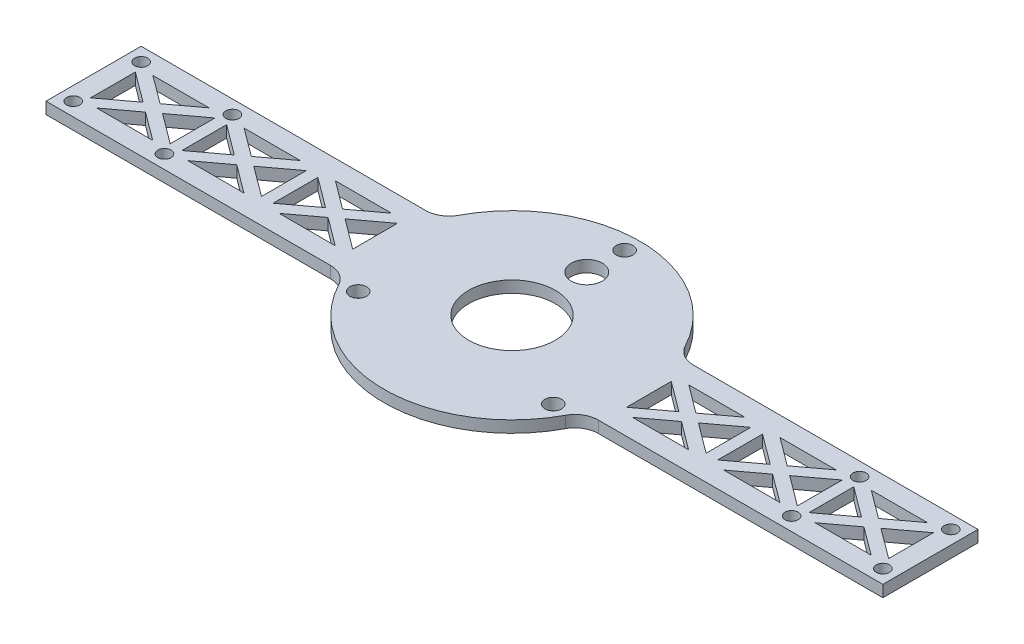
from build123d import *

# Parameters (mm, degrees)
SKETCH_2_R      = 1.7
SKETCH_2_R_2    = 11.15
SKETCH_2_R_3    = 4
SKETCH_2_R_4    = 2.15
EXTRUDE_1_DEPTH = 3


with BuildPart() as part:
    # 草图2 → 凸台-拉伸1 (new body)
    with BuildSketch(Plane(origin=(0, 0, 0), x_dir=(1, 0, 0), z_dir=(0, 1, 0))):
        with BuildLine():
            Line((-3.5, -3.5), (69.783530787, -3.5))
            ThreePointArc((69.783530787, -3.5), (72.878191201, -4.359661789), (75.086064512, -6.692307692))
            ThreePointArc((75.086064512, -6.692307692), (104.25, -24.25), (133.413935488, -6.692307692))
            ThreePointArc((133.413935488, -6.692307692), (135.621808799, -4.359661789), (138.716469213, -3.5))
            Line((138.716469213, -3.5), (212, -3.5))
            Line((212, -3.5), (212, 21))
            Line((212, 21), (138.716469213, 21))
            ThreePointArc((138.716469213, 21), (135.621808799, 21.859661789), (133.413935488, 24.192307692))
            ThreePointArc((133.413935488, 24.192307692), (104.25, 41.75), (75.086064512, 24.192307692))
            ThreePointArc((75.086064512, 24.192307692), (72.878191201, 21.859661789), (69.783530787, 21))
            Line((69.783530787, 21), (-3.5, 21))
            Line((-3.5, 21), (-3.5, -3.5))
        make_face()
        with Locations(Location((0, 17.5, 0), (0, 0, 270))):
            Circle(SKETCH_2_R, mode=Mode.SUBTRACT)
        with Locations(Location((23.5, 17.5, 0), (0, 0, 270))):
            Circle(SKETCH_2_R, mode=Mode.SUBTRACT)
        with Locations(Location((0, 0, 0), (0, 0, 270))):
            Circle(SKETCH_2_R, mode=Mode.SUBTRACT)
        with Locations(Location((23.5, 0, 0), (0, 0, 270))):
            Circle(SKETCH_2_R, mode=Mode.SUBTRACT)
        with Locations(Location((104.25, 8.75, 0), (0, 0, 270))):
            Circle(SKETCH_2_R_2, mode=Mode.SUBTRACT)
        with Locations(Location((104.25, 28, 0), (0, 0, 270))):
            Circle(SKETCH_2_R_3, mode=Mode.SUBTRACT)
        with Locations(Location((104.25, 37.75, 0), (0, 0, 270))):
            Circle(SKETCH_2_R_4, mode=Mode.SUBTRACT)
        with Locations(Location((185, 0, 0), (0, 0, 90))):
            Circle(SKETCH_2_R, mode=Mode.SUBTRACT)
        with Locations(Location((208.5, 0, 0), (0, 0, 90))):
            Circle(SKETCH_2_R, mode=Mode.SUBTRACT)
        with Locations(Location((208.5, 17.5, 0), (0, 0, 90))):
            Circle(SKETCH_2_R, mode=Mode.SUBTRACT)
        with Locations(Location((185, 17.5, 0), (0, 0, 90))):
            Circle(SKETCH_2_R, mode=Mode.SUBTRACT)
        with Locations(Location((129.36473671, -5.75, 0), (0, 0, 270))):
            Circle(SKETCH_2_R_4, mode=Mode.SUBTRACT)
        with Locations(Location((79.13526329, -5.75, 0), (0, 0, 270))):
            Circle(SKETCH_2_R_4, mode=Mode.SUBTRACT)
        Polygon((4.525728913, 16), (18.974271087, 16), (11.75, 10.620223658), align=None, mode=Mode.SUBTRACT)
        Polygon((1.5, 14.512755065), (1.5, 2.987244935), (9.238556802, 8.75), align=None, mode=Mode.SUBTRACT)
        Polygon((189.525728913, 16), (196.75, 10.620223658), (203.974271087, 16), align=None, mode=Mode.SUBTRACT)
        Polygon((207, 2.987244935), (199.261443198, 8.75), (207, 14.512755065), align=None, mode=Mode.SUBTRACT)
        Polygon((14.261443198, 8.75), (22, 2.987244935), (22, 14.512755065), align=None, mode=Mode.SUBTRACT)
        Polygon((11.75, 6.879776342), (18.974271087, 1.5), (4.525728913, 1.5), align=None, mode=Mode.SUBTRACT)
        Polygon((42.474271087, 1.5), (28.025728913, 1.5), (35.25, 6.879776342), align=None, mode=Mode.SUBTRACT)
        Polygon((32.738556802, 8.75), (25, 14.512755065), (25, 2.987244935), align=None, mode=Mode.SUBTRACT)
        Polygon((35.25, 10.620223658), (28.025728913, 16), (42.474271087, 16), align=None, mode=Mode.SUBTRACT)
        Polygon((45.5, 14.512755065), (37.761443198, 8.75), (45.5, 2.987244935), align=None, mode=Mode.SUBTRACT)
        Polygon((51.525728913, 16), (65.974271087, 16), (58.75, 10.620223658), align=None, mode=Mode.SUBTRACT)
        Polygon((51.525728913, 1.5), (58.75, 6.879776342), (65.974271087, 1.5), align=None, mode=Mode.SUBTRACT)
        Polygon((61.261443198, 8.75), (69, 2.987244935), (69, 14.512755065), align=None, mode=Mode.SUBTRACT)
        Polygon((56.238556802, 8.75), (48.5, 14.512755065), (48.5, 2.987244935), align=None, mode=Mode.SUBTRACT)
        Polygon((142.525728913, 1.5), (156.974271087, 1.5), (149.75, 6.879776342), align=None, mode=Mode.SUBTRACT)
        Polygon((139.5, 14.512755065), (147.238556802, 8.75), (139.5, 2.987244935), align=None, mode=Mode.SUBTRACT)
        Polygon((149.75, 10.620223658), (156.974271087, 16), (142.525728913, 16), align=None, mode=Mode.SUBTRACT)
        Polygon((160, 2.987244935), (152.261443198, 8.75), (160, 14.512755065), align=None, mode=Mode.SUBTRACT)
        Polygon((173.25, 6.879776342), (166.025728913, 1.5), (180.474271087, 1.5), align=None, mode=Mode.SUBTRACT)
        Polygon((163, 2.987244935), (163, 14.512755065), (170.738556802, 8.75), align=None, mode=Mode.SUBTRACT)
        Polygon((166.025728913, 16), (173.25, 10.620223658), (180.474271087, 16), align=None, mode=Mode.SUBTRACT)
        Polygon((183.5, 2.987244935), (175.761443198, 8.75), (183.5, 14.512755065), align=None, mode=Mode.SUBTRACT)
        Polygon((186.5, 2.987244935), (186.5, 14.512755065), (194.238556802, 8.75), align=None, mode=Mode.SUBTRACT)
        Polygon((189.525728913, 1.5), (203.974271087, 1.5), (196.75, 6.879776342), align=None, mode=Mode.SUBTRACT)
    extrude(amount=EXTRUDE_1_DEPTH)


solid = part.part
